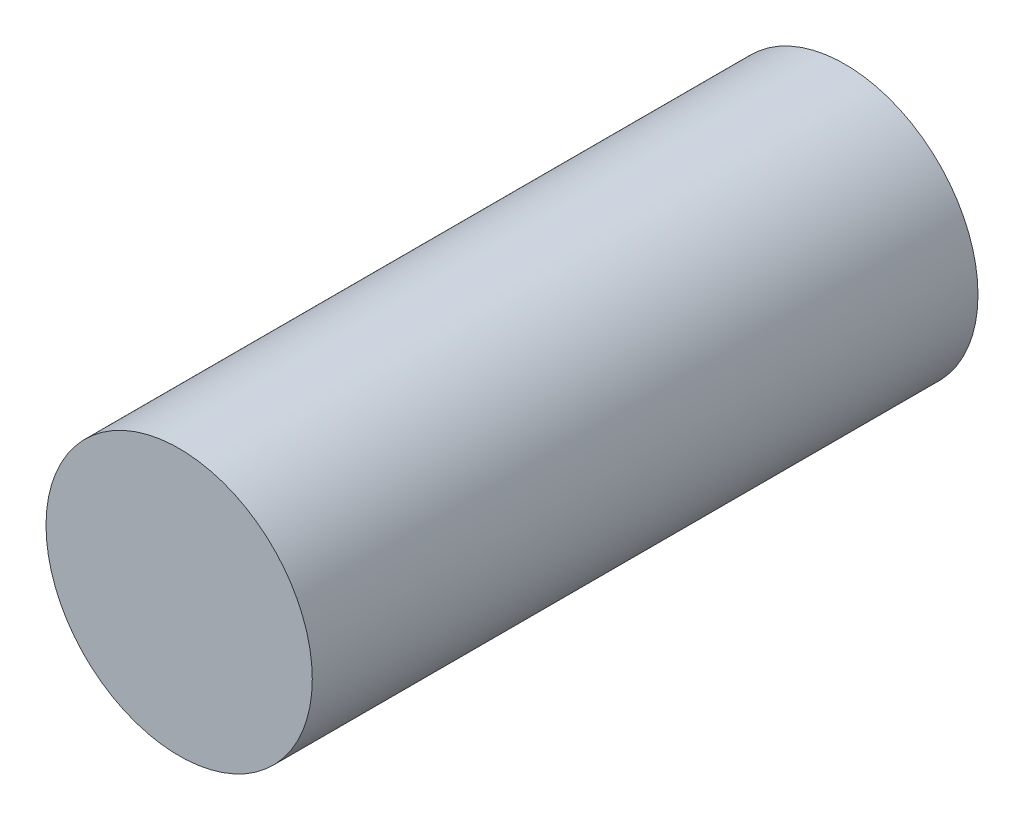
from build123d import *

# Parameters (mm, degrees)
SKETCH_1_R      = 5
EXTRUDE_1_DEPTH = 25


with BuildPart() as part:
    # 草图1 → 凸台-拉伸1 (new body)
    with BuildSketch(Plane.XY):
        Circle(SKETCH_1_R)
    extrude(amount=EXTRUDE_1_DEPTH)


solid = part.part
